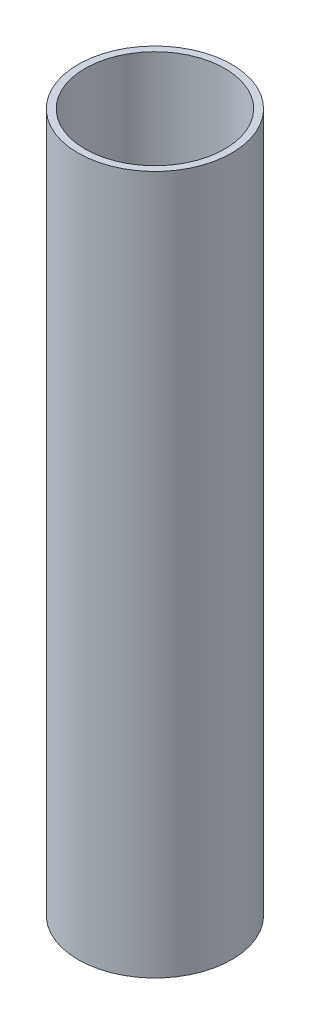
from build123d import *

# Parameters (mm, degrees)
SKETCH_1_R      = 55
SKETCH_1_R_2    = 50
EXTRUDE_1_DEPTH = 500


with BuildPart() as part:
    # 草图1 → 凸台-拉伸1 (new body)
    with BuildSketch(Plane(origin=(0, 0, 0), x_dir=(1, 0, 0), z_dir=(0, 1, 0))):
        with Locations(Location((0, 0, 0), (0, 0, 270))):
            Circle(SKETCH_1_R)
        with Locations(Location((0, 0, 0), (0, 0, 270))):
            Circle(SKETCH_1_R_2, mode=Mode.SUBTRACT)
    extrude(amount=EXTRUDE_1_DEPTH)


solid = part.part
